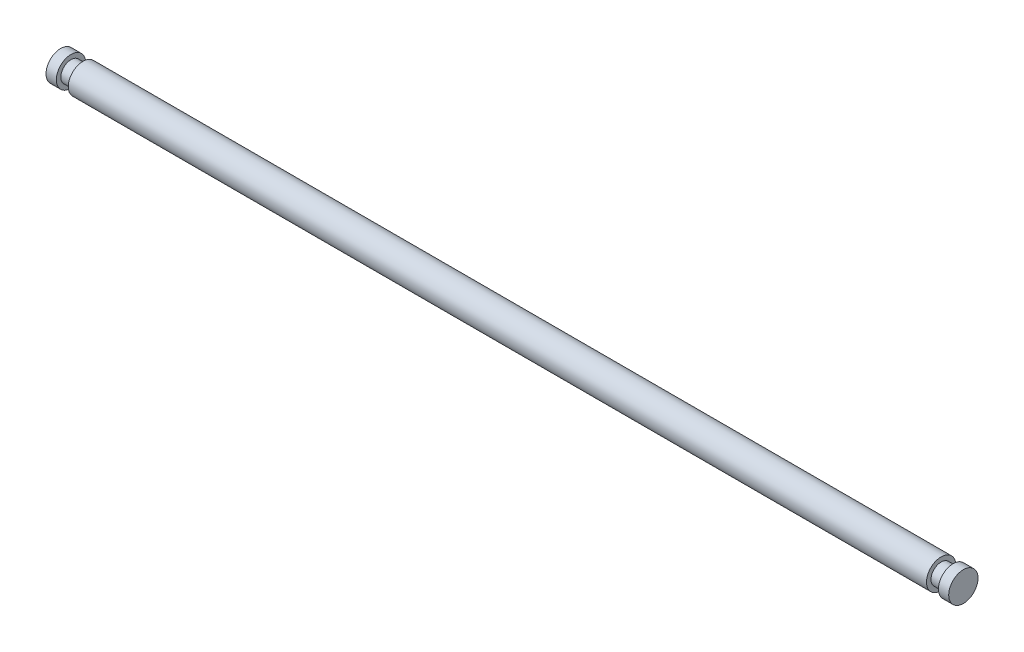
from build123d import *


with BuildPart() as part:
    # Sketch1 → Revolve1 (revolve)
    with BuildSketch(Plane(origin=(0, 0, 0), x_dir=(0, 1, 0), z_dir=(0, 0, 1)), mode=Mode.PRIVATE) as revolve1_sk:
        Polygon((0, 0), (31.73095, 0), (31.73095, -22.352), (22.0218, -22.352), (22.0218, -48.1584), (31.73095, -48.1584), (31.73095, -1904.7206), (22.0218, -1904.7206), (22.0218, -1930.527), (31.73095, -1930.527), (31.73095, -1952.752), (0, -1952.752), align=None)
    revolve(revolve1_sk.sketch.rotate(Axis((-25.4, 0, 0), (1, 0, 0)), 90), axis=Axis((-25.4, 0, 0), (1, 0, 0)))


solid = part.part
